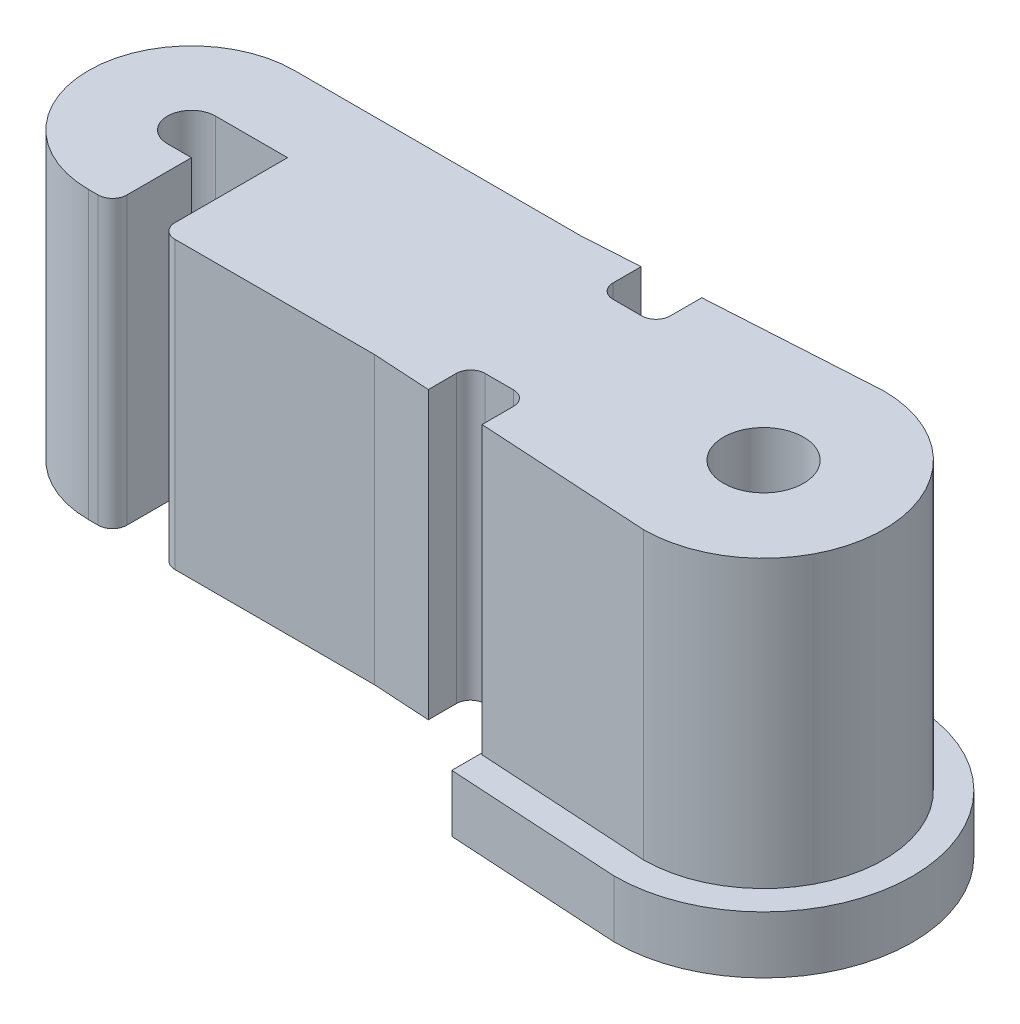
from build123d import *

# Parameters (mm, degrees)
BOSS_EXTRUDE1_DEPTH = 2.5
SKETCH4_R           = 0.35
THROUGH_HOLES_DEPTH = 7.493265742
FILLET1_R           = 0.125
SKETCH5_R           = 0.125
BOSS_EXTRUDE2_DEPTH = 0.5


with BuildPart() as part:
    # Sketch3 → Boss-Extrude1 (new body)
    with BuildSketch(Plane(origin=(0, 0, 0), x_dir=(1, 0, 0), z_dir=(0, 1, 0))):
        with BuildLine():
            Line((-2.5, 0.9), (-2, 0.93))
            Line((-2, 0.93), (-2, 0.56))
            Line((-2, 0.56), (-1.5, 0.56))
            Line((-1.5, 0.56), (-1.5, 0.96))
            Line((-1.5, 0.96), (0, 1.05))
            ThreePointArc((0, 1.05), (1.05, 0), (0, -1.05))
            Line((0, -1.05), (-1.5, -0.96))
            Line((-1.5, -0.96), (-1.5, -0.56))
            Line((-1.5, -0.56), (-2, -0.56))
            Line((-2, -0.56), (-2, -0.93))
            Line((-2, -0.93), (-2.5, -0.9))
            Line((-2.5, -0.9), (-5, -0.9))
            ThreePointArc((-5, -0.9), (-5.9, 0), (-5, 0.9))
            Line((-5, 0.9), (-2.5, 0.9))
        make_face()
    extrude(amount=BOSS_EXTRUDE1_DEPTH)

    # Sketch4 → Through Holes (cut, through all)
    with BuildSketch(Plane(origin=(0, 2.5, 0), x_dir=(1, 0, 0), z_dir=(0, 1, 0))):
        with Locations(Location((0, 0, 0), (0, 0, 270))):
            Circle(SKETCH4_R)
        with BuildLine():
            Line((-4.79, -0.9), (-4.37, -0.9))
            Line((-4.37, -0.9), (-4.37, 0.21))
            Line((-4.37, 0.21), (-5, 0.21))
            ThreePointArc((-5, 0.21), (-5.21, 0), (-5, -0.21))
            Line((-5, -0.21), (-4.79, -0.21))
            Line((-4.79, -0.21), (-4.79, -0.9))
        make_face()
    extrude(amount=-THROUGH_HOLES_DEPTH, mode=Mode.SUBTRACT)

    # Fillet1
    fillet1_edges = [part.edges().sort_by_distance(p)[0] for p in [
        (-2, 1.25, 0.56),
        (-1.5, 1.25, 0.56),
        (-1.5, 1.25, -0.56),
        (-2, 1.25, -0.56),
        (-4.37, 1.25, 0.9),
        (-4.79, 1.25, 0.9),
    ]]
    fillet(fillet1_edges, radius=FILLET1_R)

    # Sketch5 → Boss-Extrude2 (add)
    with BuildSketch(Plane(origin=(0, 0, 0), x_dir=(1, 0, 0), z_dir=(0, 1, 0))):
        with BuildLine():
            Line((-1.514973073, -1.209551211), (-1.514973073, 1.209551211))
            Line((-1.514973073, 1.209551211), (-0.007892579, 1.299976041))
            ThreePointArc((-0.007892579, 1.299976041), (1.3, 0), (-0.007892579, -1.299976041))
            Line((-0.007892579, -1.299976041), (-1.514973073, -1.209551211))
        make_face()
        with Locations(Location((0, 0, 0), (0, 0, 270))):
            Circle(SKETCH5_R, mode=Mode.SUBTRACT)
    extrude(amount=-BOSS_EXTRUDE2_DEPTH)


solid = part.part
